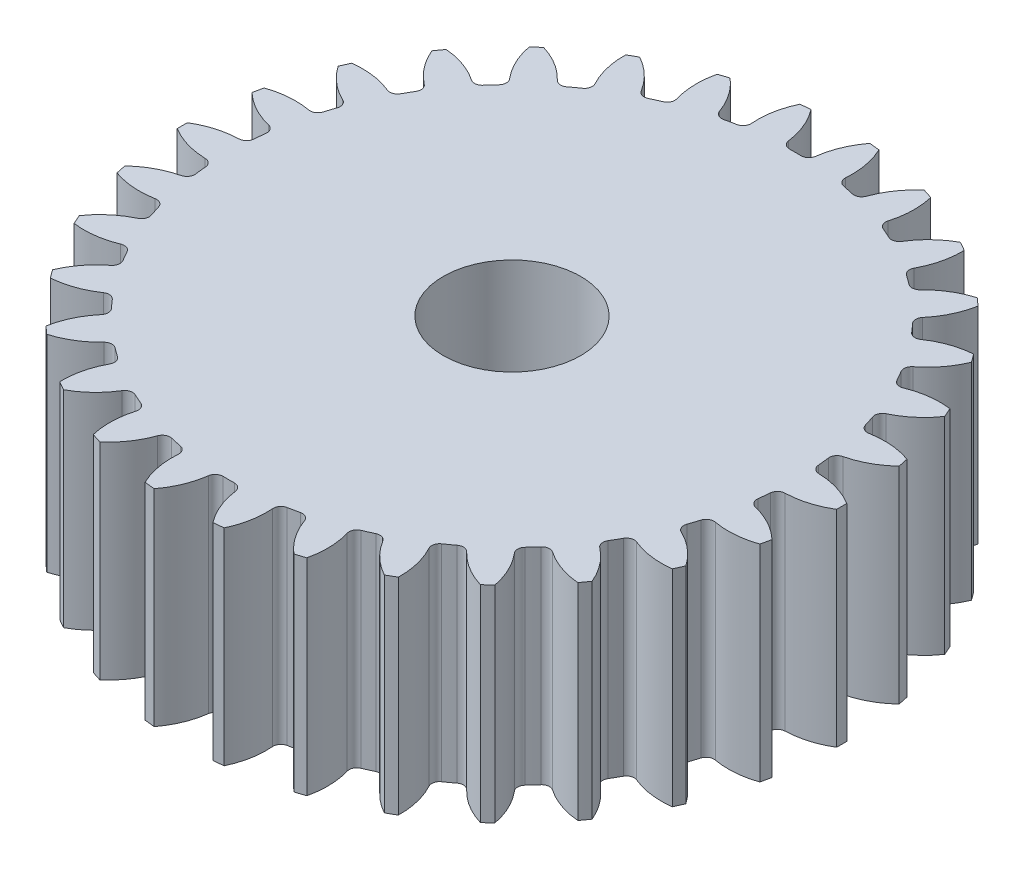
from build123d import *

# Parameters (mm, degrees)
SKETCH1_R                = 24
SKETCH1_R_2              = 5
BOSS_EXTRUDE1_DEPTH      = 15
CUT_EXTRUDE1_DEPTH       = 15
FILLET1_R                = 0.57
CIRPATTERN1_COUNT        = 30
FILLET1_OF_CIRPATTERN1_R = 0.57
SCALE1_SCALE             = 10


with BuildPart() as part:
    # Sketch1 → Boss-Extrude1 (new body)
    with BuildSketch(Plane(origin=(0, 0, 0), x_dir=(1, 0, 0), z_dir=(0, 1, 0))):
        with Locations(Location((0, 0, 0), (0, 0, 270))):
            Circle(SKETCH1_R)
        with Locations(Location((0, 0, 0), (0, 0, 270))):
            Circle(SKETCH1_R_2, mode=Mode.SUBTRACT)
    extrude(amount=BOSS_EXTRUDE1_DEPTH)

    # Sketch2 → Cut-Extrude1 (cut)
    with BuildSketch(Plane(origin=(0, 0, 0), x_dir=(1, 0, 0), z_dir=(0, 1, 0))):
        with BuildLine():
            ThreePointArc((0.936038672, 20.603748606), (0, 20.625), (-0.936038672, 20.603748606))
            ThreePointArc((-0.936038672, 20.603748606), (-1.284214385, 22.346103863), (-2.137460686, 23.90462846))
            ThreePointArc((-2.137460686, 23.90462846), (0, 24), (2.137460686, 23.90462846))
            ThreePointArc((2.137460686, 23.90462846), (1.284214385, 22.346103863), (0.936038672, 20.603748606))
        make_face()
    cut_extrude1 = extrude(amount=CUT_EXTRUDE1_DEPTH, mode=Mode.SUBTRACT)

    # Fillet1
    fillet1_edges = [part.edges().sort_by_distance(p)[0] for p in [
        (0.936038672, 7.5, -20.603748606),
        (-0.936038672, 7.5, -20.603748606),
    ]]
    fillet(fillet1_edges, radius=FILLET1_R)

    # CirPattern1: Cut-Extrude1 ×30 about axis
    cirpattern1_axis = Axis((0, 0, 0), (0, 1, 0))
    for i in range(1, CIRPATTERN1_COUNT):
        add(cut_extrude1.rotate(cirpattern1_axis, i * 360 / CIRPATTERN1_COUNT), mode=Mode.SUBTRACT)

    # Fillet1 of CirPattern1
    fillet1_of_cirpattern1_edges = [part.edges().sort_by_distance(p)[0] for p in [
        (-3.368176229, 7.5, -20.348120648),
        (-5.199344191, 7.5, -19.958893882),
        (-7.525185666, 7.5, -19.203182176),
        (-9.235413419, 7.5, -18.441739722),
        (-11.353308379, 7.5, -17.218972497),
        (-12.867850765, 7.5, -16.118593043),
        (-14.685237038, 7.5, -14.482211093),
        (-15.937901286, 7.5, -13.090986502),
        (-17.37535037, 7.5, -11.112507572),
        (-18.311389042, 7.5, -9.491241034),
        (-19.306077515, 7.5, -7.257134145),
        (-19.884581228, 7.5, -5.476682789),
        (-20.393036431, 7.5, -3.084589133),
        (-20.588721799, 7.5, -1.222767225),
        (-20.588721799, 7.5, 1.222767225),
        (-20.393036431, 7.5, 3.084589133),
        (-19.884581228, 7.5, 5.476682789),
        (-19.306077515, 7.5, 7.257134145),
        (-18.311389042, 7.5, 9.491241034),
        (-17.37535037, 7.5, 11.112507572),
        (-15.937901286, 7.5, 13.090986502),
        (-14.685237038, 7.5, 14.482211093),
        (-12.867850765, 7.5, 16.118593043),
        (-11.353308379, 7.5, 17.218972497),
        (-9.235413419, 7.5, 18.441739722),
        (-7.525185666, 7.5, 19.203182176),
        (-5.199344191, 7.5, 19.958893882),
        (-3.368176229, 7.5, 20.348120648),
        (-0.936038672, 7.5, 20.603748606),
        (0.936038672, 7.5, 20.603748606),
        (3.368176229, 7.5, 20.348120648),
        (5.199344191, 7.5, 19.958893882),
        (7.525185666, 7.5, 19.203182176),
        (9.235413419, 7.5, 18.441739722),
        (11.353308379, 7.5, 17.218972497),
        (12.867850765, 7.5, 16.118593043),
        (14.685237038, 7.5, 14.482211093),
        (15.937901286, 7.5, 13.090986502),
        (17.37535037, 7.5, 11.112507572),
        (18.311389042, 7.5, 9.491241034),
        (19.306077515, 7.5, 7.257134145),
        (19.884581228, 7.5, 5.476682789),
        (20.393036431, 7.5, 3.084589133),
        (20.588721799, 7.5, 1.222767225),
        (20.588721799, 7.5, -1.222767225),
        (20.393036431, 7.5, -3.084589133),
        (19.884581228, 7.5, -5.476682789),
        (19.306077515, 7.5, -7.257134145),
        (18.311389042, 7.5, -9.491241034),
        (17.37535037, 7.5, -11.112507572),
        (15.937901286, 7.5, -13.090986502),
        (14.685237038, 7.5, -14.482211093),
        (12.867850765, 7.5, -16.118593043),
        (11.353308379, 7.5, -17.218972497),
        (9.235413419, 7.5, -18.441739722),
        (7.525185666, 7.5, -19.203182176),
        (5.199344191, 7.5, -19.958893882),
        (3.368176229, 7.5, -20.348120648),
    ]]
    fillet(fillet1_of_cirpattern1_edges, radius=FILLET1_OF_CIRPATTERN1_R)


with BuildPart() as part_1:
    # Scale1: scaled about (0, 7.5, -1e-09)
    add(part.part.scale(SCALE1_SCALE).moved(Location((0, -67.5, 9e-09))))


solid = part_1.part
